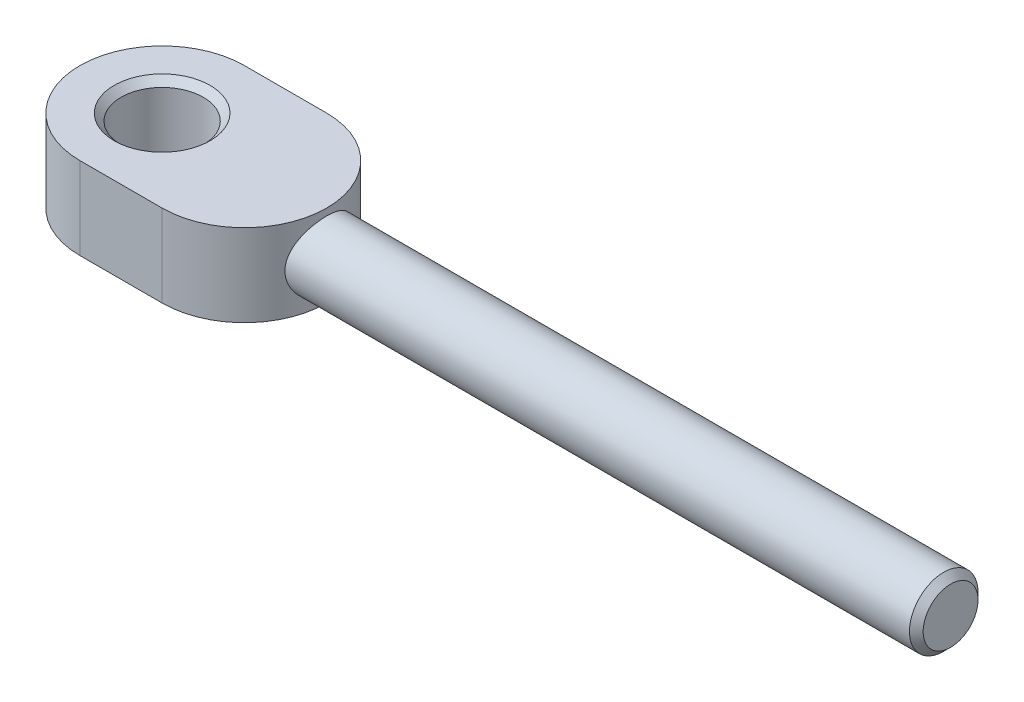
from build123d import *

# Parameters (mm, degrees)
SKETCH1_R                = 6
BOSS_EXTRUDE1_DEPTH      = 12
CHAMFER1_SIZE            = 1
BOSS_EXTRUDE2_DEPTH      = 91
BOSS_EXTRUDE2_DEPTH_BACK = 3
SKETCH2_R                = 5
CHAMFER2_SIZE            = 1


with BuildPart() as part:
    # Sketch1 → Boss-Extrude1 (new body)
    with BuildSketch(Plane(origin=(0, 0, 0), x_dir=(1, 0, 0), z_dir=(0, 1, 0))):
        with BuildLine():
            Line((0, 12), (12, 12))
            ThreePointArc((12, 12), (24, 0), (12, -12))
            Line((12, -12), (0, -12))
            ThreePointArc((0, -12), (-12, 0), (0, 12))
        make_face()
        with Locations(Location((0, 0, 0), (0, 0, 270))):
            Circle(SKETCH1_R, mode=Mode.SUBTRACT)
    extrude(amount=BOSS_EXTRUDE1_DEPTH)

    # Chamfer1
    chamfer1_edges = [part.edges().sort_by_distance(p)[0] for p in [
        (0, 0, -6),
        (0, 12, -6),
    ]]
    chamfer(chamfer1_edges, length=CHAMFER1_SIZE)

    # Sketch2 → Boss-Extrude2 (add, two sides: drawn at the far end of the back side and taken through both)
    with BuildSketch(Plane(origin=(24, 0, 0), x_dir=(0, 0, -1), z_dir=(1, 0, 0)).offset(-BOSS_EXTRUDE2_DEPTH_BACK)):
        with Locations((0, 6)):
            Circle(SKETCH2_R)
    extrude(amount=BOSS_EXTRUDE2_DEPTH + BOSS_EXTRUDE2_DEPTH_BACK)

    # Chamfer2
    chamfer2_edges = [part.edges().sort_by_distance(p)[0] for p in [
        (115, 6, 5),
    ]]
    chamfer(chamfer2_edges, length=CHAMFER2_SIZE)


solid = part.part
